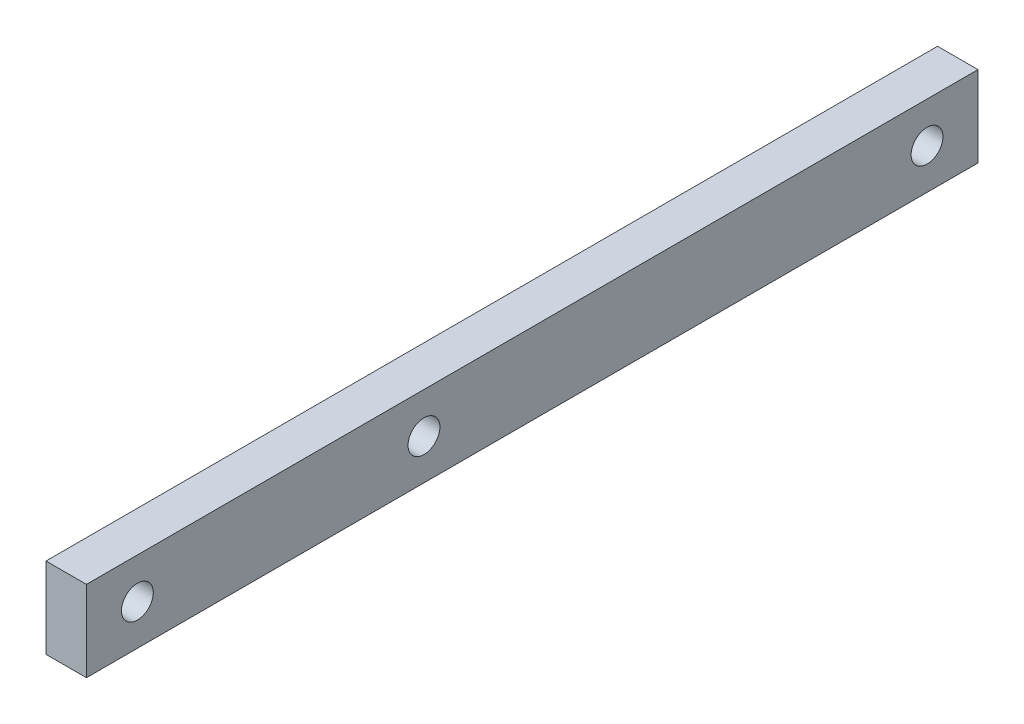
from build123d import *

# Parameters (mm, degrees)
BOSS_EXTRUDE1_DEPTH      = 70
BOSS_EXTRUDE1_DEPTH_BACK = 70
SKETCH2_W                = 6.35
SKETCH2_H                = 12.7
SKETCH4_R                = 2.5
CUT_EXTRUDE1_DEPTH       = 71.573684897


with BuildPart() as part:
    # Sketch2 → Boss-Extrude1 (new, two sides: drawn at the far end of the back side and taken through both)
    with BuildSketch(Plane.XY.offset(-BOSS_EXTRUDE1_DEPTH_BACK)):
        Rectangle(SKETCH2_W, SKETCH2_H)
    extrude(amount=BOSS_EXTRUDE1_DEPTH + BOSS_EXTRUDE1_DEPTH_BACK)

    # Sketch4 → Cut-Extrude1 (cut, through all)
    with BuildSketch(Plane(origin=(3.175, 0, 0), x_dir=(0, 0, -1), z_dir=(1, 0, 0))):
        with Locations((-62, 0)):
            Circle(SKETCH4_R)
        with Locations((62, 0)):
            Circle(SKETCH4_R)
        with Locations((-17, 0)):
            Circle(SKETCH4_R)
    extrude(amount=-CUT_EXTRUDE1_DEPTH, mode=Mode.SUBTRACT)


solid = part.part
